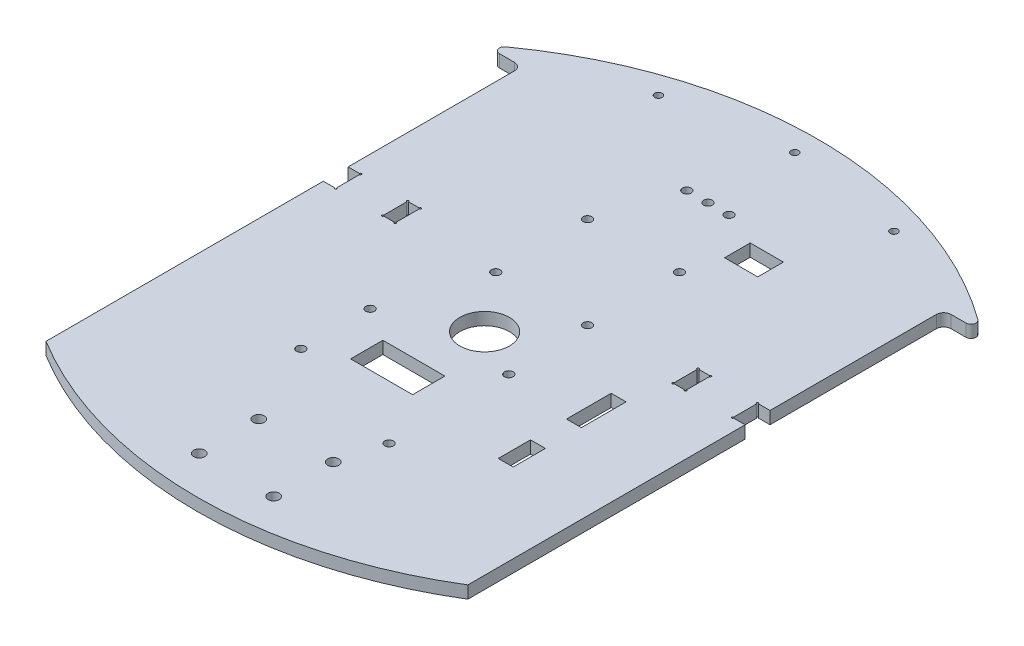
from build123d import *

# Parameters (mm, degrees)
EXTRUDE_1_DEPTH     = 5
SKETCH_3_R          = 2.25
SKETCH_3_R_2        = 1.75
SKETCH_3_R_3        = 1.5
SKETCH_3_W          = 13.356765245
SKETCH_3_H          = 10.34072148
CUT_EXTRUDE_1_DEPTH = 5
SKETCH_4_R          = 10
SKETCH_4_W          = 6
SKETCH_4_H          = 18
SKETCH_4_H_2        = 13
SKETCH_4_W_2        = 25
CUT_EXTRUDE_2_DEPTH = 166.168840415


with BuildPart() as part:
    # 草图1 → 凸台-拉伸1 (new body)
    with BuildSketch(Plane(origin=(0, 0, 0), x_dir=(1, 0, 0), z_dir=(0, 1, 0))):
        with BuildLine():
            Line((-93.991667227, 100), (-88, 100))
            ThreePointArc((-88, 100), (-85.878679656, 99.121320344), (-85, 97))
            Line((-85, 97), (-85, -91.739643711))
            ThreePointArc((-85, -91.739643711), (0, -115.681923528), (85, -91.739643711))
            Line((85, -91.739643711), (85, 97))
            ThreePointArc((85, 97), (85.878679656, 99.121320344), (88, 100))
            Line((88, 100), (93.991667227, 100))
            ThreePointArc((93.991667227, 100), (95.895095209, 101.386027753), (95.160319181, 103.62303808))
            ThreePointArc((95.160319181, 103.62303808), (0, 134.318076472), (-95.160319181, 103.62303808))
            ThreePointArc((-95.160319181, 103.62303808), (-95.895095209, 101.386027753), (-93.991667227, 100))
        make_face()
    extrude(amount=EXTRUDE_1_DEPTH)

    # 草图3 → 切除-拉伸1 (cut)
    with BuildSketch(Plane(origin=(0, 5, 0), x_dir=(1, 0, 0), z_dir=(0, 1, 0))):
        with Locations(Location((15, -100, 0), (0, 0, 270))):
            Circle(SKETCH_3_R)
        with Locations(Location((-15, -100, 0), (0, 0, 270))):
            Circle(SKETCH_3_R)
        with Locations(Location((-15, -76, 0), (0, 0, 270))):
            Circle(SKETCH_3_R)
        with Locations(Location((15, -76, 0), (0, 0, 270))):
            Circle(SKETCH_3_R)
        with Locations(Location((-18.5, 60, 0), (0, 0, 270))):
            Circle(SKETCH_3_R_2)
        with Locations(Location((18.5, 60, 0), (0, 0, 270))):
            Circle(SKETCH_3_R_2)
        with Locations(Location((18.5, 23, 0), (0, 0, 270))):
            Circle(SKETCH_3_R_2)
        with Locations(Location((-18.5, 23, 0), (0, 0, 270))):
            Circle(SKETCH_3_R_2)
        with Locations(Location((-8.5, 90, 0), (0, 0, 270))):
            Circle(SKETCH_3_R_2)
        with Locations(Location((0, 90, 0), (0, 0, 270))):
            Circle(SKETCH_3_R_2)
        with Locations(Location((8.5, 90, 0), (0, 0, 270))):
            Circle(SKETCH_3_R_2)
        with Locations(Location((0, 125, 0), (0, 0, 270))):
            Circle(SKETCH_3_R_3)
        with Locations(Location((19.76, -10, 0), (0, 0, 270))):
            Circle(SKETCH_3_R_2)
        with Locations(Location((19.76, -58.26, 0), (0, 0, 270))):
            Circle(SKETCH_3_R_2)
        with Locations(Location((-31.04, -15.08, 0), (0, 0, 270))):
            Circle(SKETCH_3_R_2)
        with Locations(Location((-31.04, -43.02, 0), (0, 0, 270))):
            Circle(SKETCH_3_R_2)
        with Locations(Location((47.445472194, 117.485375441, 0), (0, 0, 270))):
            Circle(SKETCH_3_R_3)
        with Locations(Location((-47.445472194, 117.485375441, 0), (0, 0, 270))):
            Circle(SKETCH_3_R_3)
        with BuildLine():
            Line((-85, 20), (-80.4, 20))
            ThreePointArc((-80.4, 20), (-79.717157288, 19.717157288), (-80, 20.4))
            Line((-80, 20.4), (-80, 29.6))
            ThreePointArc((-80, 29.6), (-79.717157288, 30.282842712), (-80.4, 30))
            Line((-80.4, 30), (-85, 30))
            Line((-85, 30), (-85, 20))
        make_face()
        with BuildLine():
            Line((-61, 29.6), (-61, 20.4))
            ThreePointArc((-61, 20.4), (-61.282842712, 19.717157288), (-60.6, 20))
            Line((-60.6, 20), (-56.4, 20))
            ThreePointArc((-56.4, 20), (-55.717157288, 19.717157288), (-56, 20.4))
            Line((-56, 20.4), (-56, 29.6))
            ThreePointArc((-56, 29.6), (-55.717157288, 30.282842712), (-56.4, 30))
            Line((-56.4, 30), (-60.6, 30))
            ThreePointArc((-60.6, 30), (-61.282842712, 30.282842712), (-61, 29.6))
        make_face()
        with BuildLine():
            Line((61, 29.6), (61, 20.4))
            ThreePointArc((61, 20.4), (61.282842712, 19.717157288), (60.6, 20))
            Line((60.6, 20), (56.4, 20))
            ThreePointArc((56.4, 20), (55.717157288, 19.717157288), (56, 20.4))
            Line((56, 20.4), (56, 29.6))
            ThreePointArc((56, 29.6), (55.717157288, 30.282842712), (56.4, 30))
            Line((56.4, 30), (60.6, 30))
            ThreePointArc((60.6, 30), (61.282842712, 30.282842712), (61, 29.6))
        make_face()
        with BuildLine():
            Line((85, 30), (85, 20))
            Line((85, 20), (80.4, 20))
            ThreePointArc((80.4, 20), (79.717157288, 19.717157288), (80, 20.4))
            Line((80, 20.4), (80, 29.6))
            ThreePointArc((80, 29.6), (79.717157288, 30.282842712), (80.4, 30))
            Line((80.4, 30), (85, 30))
        make_face()
        with Locations((29.239040261, 79.304944158)):
            Rectangle(SKETCH_3_W, SKETCH_3_H)
    extrude(amount=-CUT_EXTRUDE_1_DEPTH, mode=Mode.SUBTRACT)

    # 草图4 → 切除-拉伸2 (cut, through all)
    with BuildSketch(Plane(origin=(0, 5, 0), x_dir=(1, 0, 0), z_dir=(0, 1, 0))):
        with Locations(Location((0, 0, 0), (0, 0, 270))):
            Circle(SKETCH_4_R)
        with Locations((50, -5)):
            Rectangle(SKETCH_4_W, SKETCH_4_H)
        with Locations((50, -35)):
            Rectangle(SKETCH_4_W, SKETCH_4_H_2)
        with Locations((-5, -30)):
            Rectangle(SKETCH_4_W_2, SKETCH_4_H_2)
    extrude(amount=-CUT_EXTRUDE_2_DEPTH, mode=Mode.SUBTRACT)


solid = part.part
